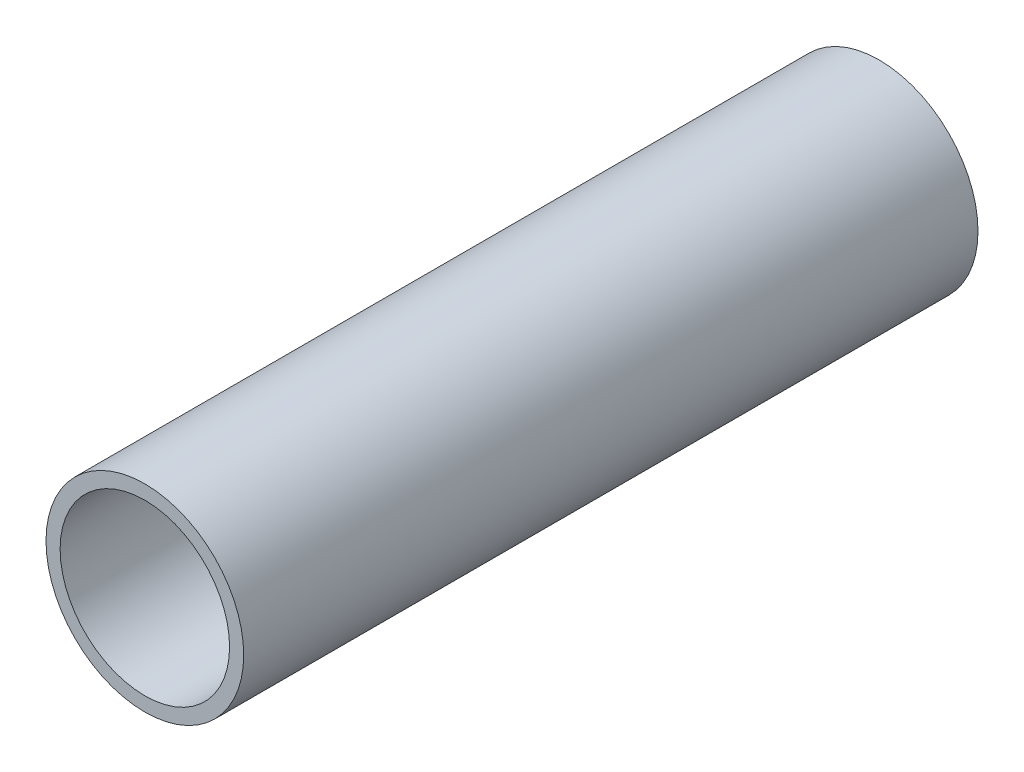
from build123d import *

# Parameters (mm, degrees)
SKETCH1_R           = 11.1125
SKETCH1_R_2         = 9.525
BOSS_EXTRUDE1_DEPTH = 41.275


with BuildPart() as part:
    # Sketch1 → Boss-Extrude1 (new, symmetric)
    with BuildSketch(Plane.XY):
        Circle(SKETCH1_R)
        Circle(SKETCH1_R_2, mode=Mode.SUBTRACT)
    extrude(amount=BOSS_EXTRUDE1_DEPTH, both=True)


solid = part.part
